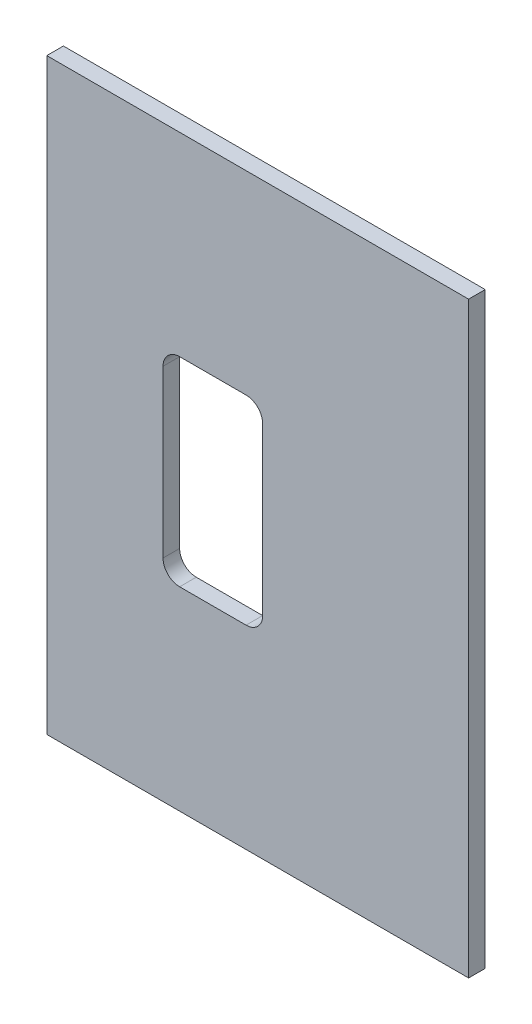
from build123d import *

# Parameters (mm, degrees)
SKETCH1_W           = 80.645
SKETCH1_H           = 112.395
SKETCH1_W_2         = 19.05
SKETCH1_H_2         = 38.1
BOSS_EXTRUDE1_DEPTH = 3.175
FILLET1_R           = 3.175


with BuildPart() as part:
    # Sketch1 → Boss-Extrude1 (new body)
    with BuildSketch(Plane.XY):
        Rectangle(SKETCH1_W, SKETCH1_H)
        with Locations((-8.5725, 0)):
            Rectangle(SKETCH1_W_2, SKETCH1_H_2, mode=Mode.SUBTRACT)
    extrude(amount=BOSS_EXTRUDE1_DEPTH)

    # Fillet1
    fillet1_edges = [part.edges().sort_by_distance(p)[0] for p in [
        (-18.0975, -19.05, 1.5875),
        (0.9525, -19.05, 1.5875),
        (0.9525, 19.05, 1.5875),
        (-18.0975, 19.05, 1.5875),
    ]]
    fillet(fillet1_edges, radius=FILLET1_R)


solid = part.part
